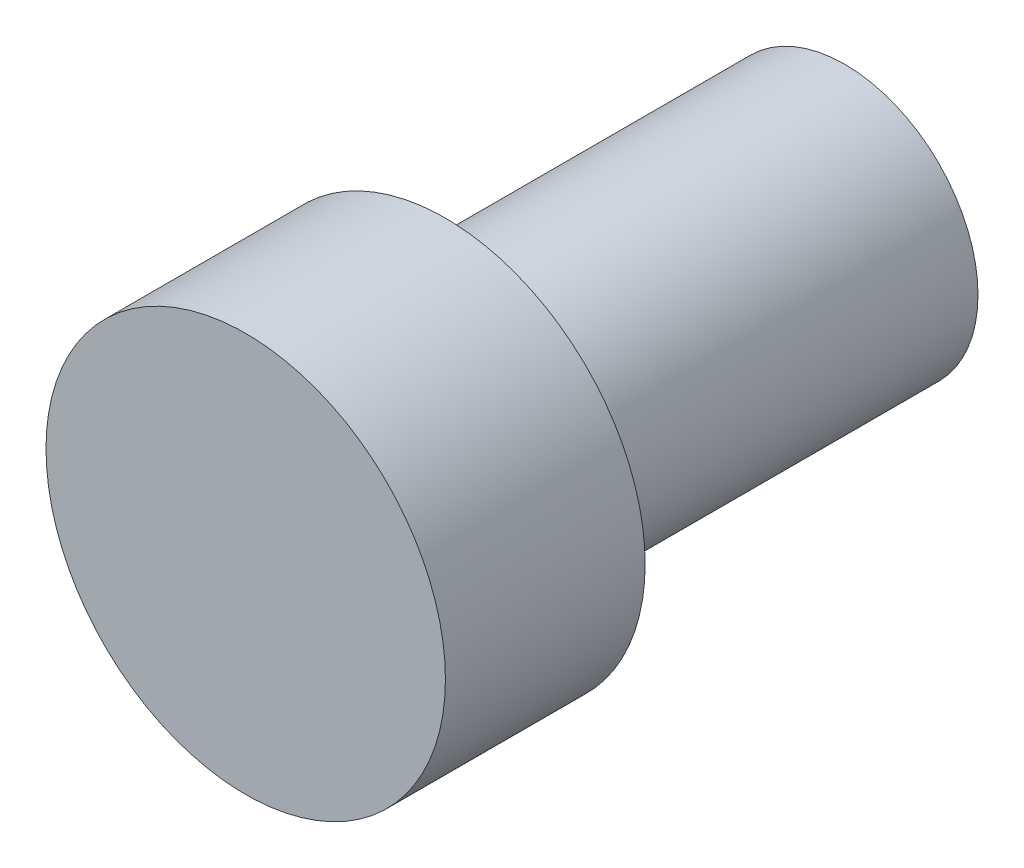
from build123d import *

# Parameters (mm, degrees)
SKETCH_1_R      = 2
EXTRUDE_1_DEPTH = 6
SKETCH_2_R      = 3
EXTRUDE_2_DEPTH = 3


with BuildPart() as part:
    # 草图1 → 凸台-拉伸1 (new body)
    with BuildSketch(Plane.XY):
        Circle(SKETCH_1_R)
    extrude(amount=EXTRUDE_1_DEPTH)

    # 草图2 → 凸台-拉伸2 (add)
    with BuildSketch(Plane.XY.offset(6)):
        Circle(SKETCH_2_R)
    extrude(amount=EXTRUDE_2_DEPTH)


solid = part.part
